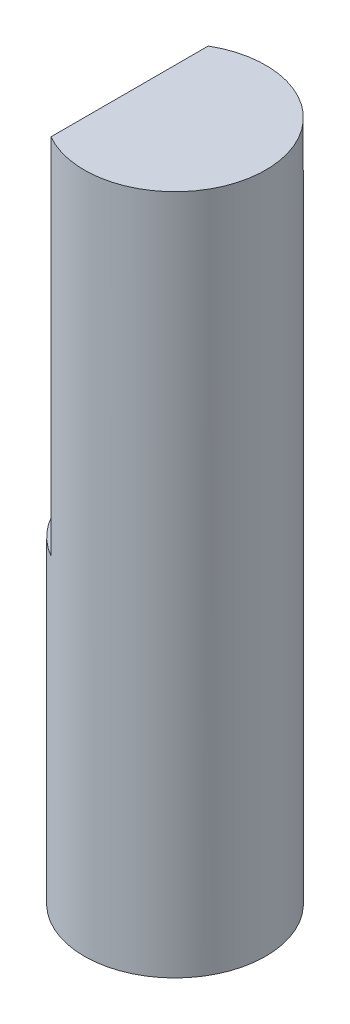
from build123d import *

# Parameters (mm, degrees)
SKETCH1_R           = 2
BOSS_EXTRUDE1_DEPTH = 15
CUT_EXTRUDE1_START  = -8
CUT_EXTRUDE1_DEPTH  = 8


with BuildPart() as part:
    # Sketch1 → Boss-Extrude1 (new body)
    with BuildSketch(Plane(origin=(0, 0, 0), x_dir=(1, 0, 0), z_dir=(0, 1, 0))):
        with Locations(Location((0, 0, 0), (0, 0, 270))):
            Circle(SKETCH1_R)
    extrude(amount=BOSS_EXTRUDE1_DEPTH)

    # Sketch2 → Cut-Extrude1 (cut)
    with BuildSketch(Plane(origin=(0, 15, 0), x_dir=(1, 0, 0), z_dir=(0, 1, 0)).offset(CUT_EXTRUDE1_START)):
        with BuildLine():
            Line((-1, 1.732050808), (-1, -1.732050808))
            ThreePointArc((-1, -1.732050808), (-2, 0), (-1, 1.732050808))
        make_face()
    extrude(amount=CUT_EXTRUDE1_DEPTH, mode=Mode.SUBTRACT)


solid = part.part
